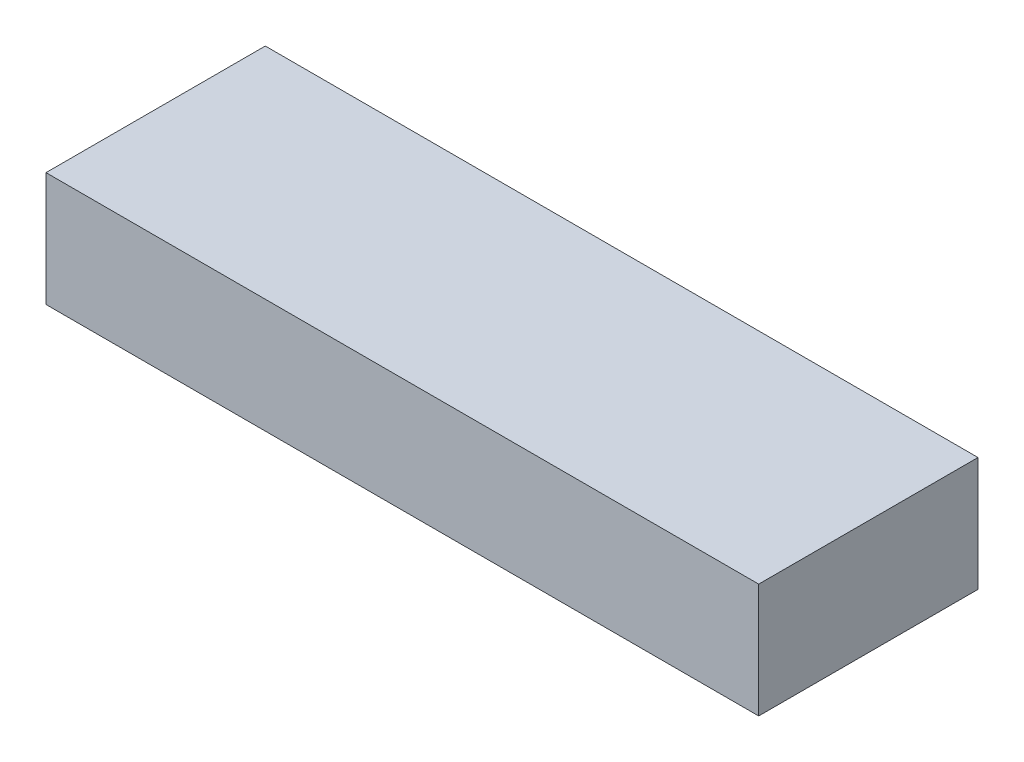
from build123d import *

# Parameters (mm, degrees)
ESQUISSE1_W        = 156
ESQUISSE1_H        = 48
BOSS_EXTRU_1_DEPTH = 25


with BuildPart() as part:
    # Esquisse1 → Boss.-Extru.1 (new body)
    with BuildSketch(Plane(origin=(0, 0, 0), x_dir=(1, 0, 0), z_dir=(0, 1, 0))):
        Rectangle(ESQUISSE1_W, ESQUISSE1_H)
    extrude(amount=BOSS_EXTRU_1_DEPTH)


solid = part.part
